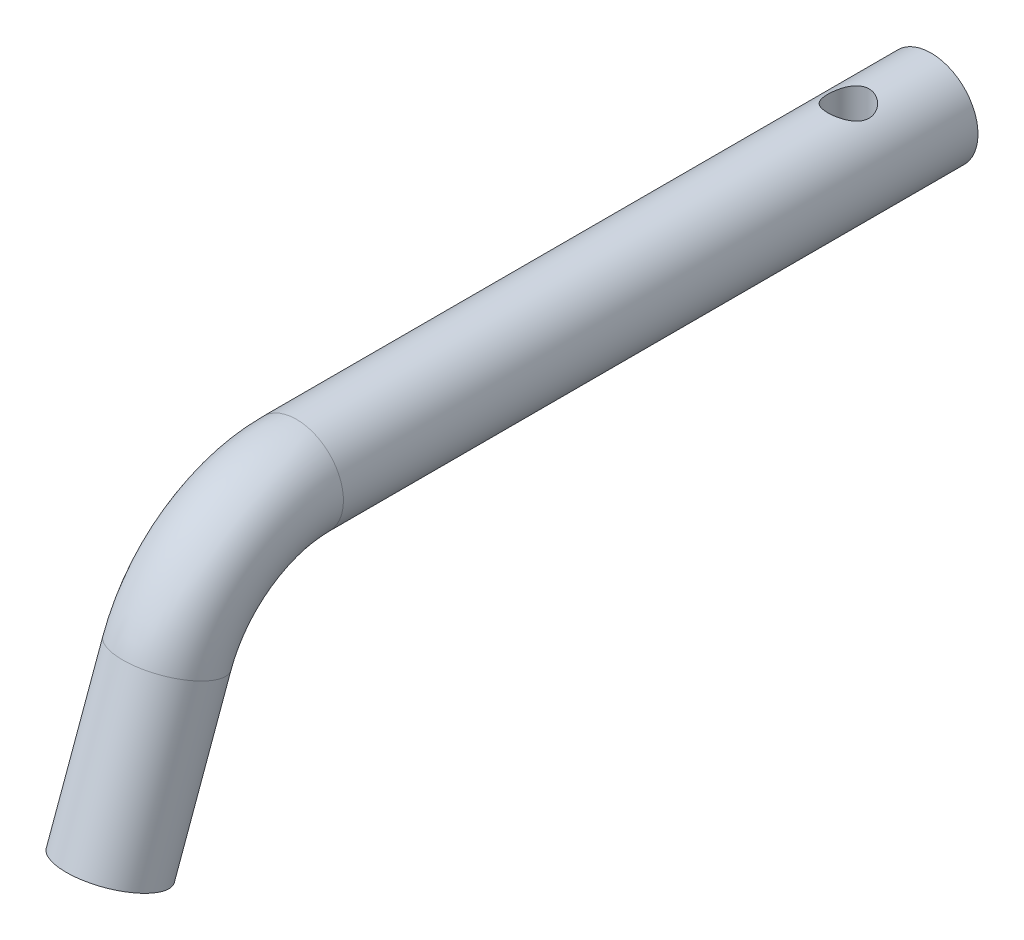
from build123d import *

# Parameters (mm, degrees)
SKETCH2_R               = 8.5
CUT_EXTRUDE1_DEPTH      = 165.013821113
CUT_EXTRUDE1_DEPTH_BACK = 165.013821113
SKETCH3_R               = 3.75


with BuildPart() as part:
    # Sweep1: sweep along a path in Sketch1
    with BuildLine(Plane(origin=(0, 0, 0), x_dir=(0, 0, -1), z_dir=(1, 0, 0))) as sweep1_path:
        Line((0, 0), (-115, 0))
        ThreePointArc((-115, 0), (-129.339410909, -4.521198893), (-138.49231552, -16.449496417))
        Line((-138.49231552, -16.449496417), (-148.752919819, -44.64027504))
    # Sketch2 → Sweep1 (sweep)
    with BuildSketch(Plane.XY):
        Circle(SKETCH2_R)
    sweep(path=sweep1_path.line)

    # Sketch3 → Cut-Extrude1 (cut, two sides: drawn at the far end of the back side and taken through both)
    with BuildSketch(Plane(origin=(0, 0, 0), x_dir=(1, 0, 0), z_dir=(0, 1, 0)).offset(-CUT_EXTRUDE1_DEPTH_BACK)):
        with Locations(Location((0, -15, 0), (0, 0, 270))):
            Circle(SKETCH3_R)
    extrude(amount=CUT_EXTRUDE1_DEPTH + CUT_EXTRUDE1_DEPTH_BACK, mode=Mode.SUBTRACT)


solid = part.part
